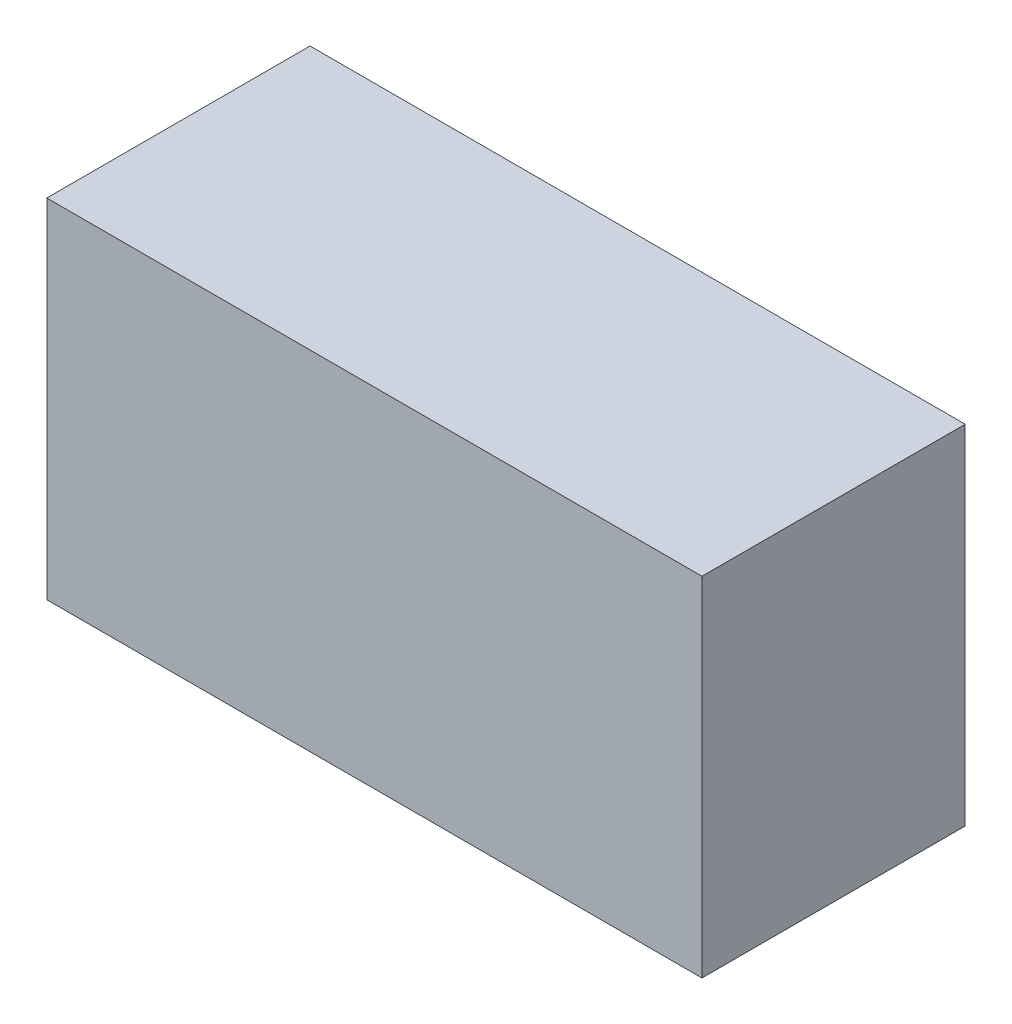
from build123d import *

# Parameters (mm, degrees)
SKETCH1_W               = 2.4888
SKETCH1_H               = 1.3216
COMPONENT_OUTLINE_DEPTH = 1


with BuildPart() as part:
    # Sketch1 → Component_Outline (new body)
    with BuildSketch(Plane.XY):
        Rectangle(SKETCH1_W, SKETCH1_H)
    extrude(amount=COMPONENT_OUTLINE_DEPTH)


solid = part.part
